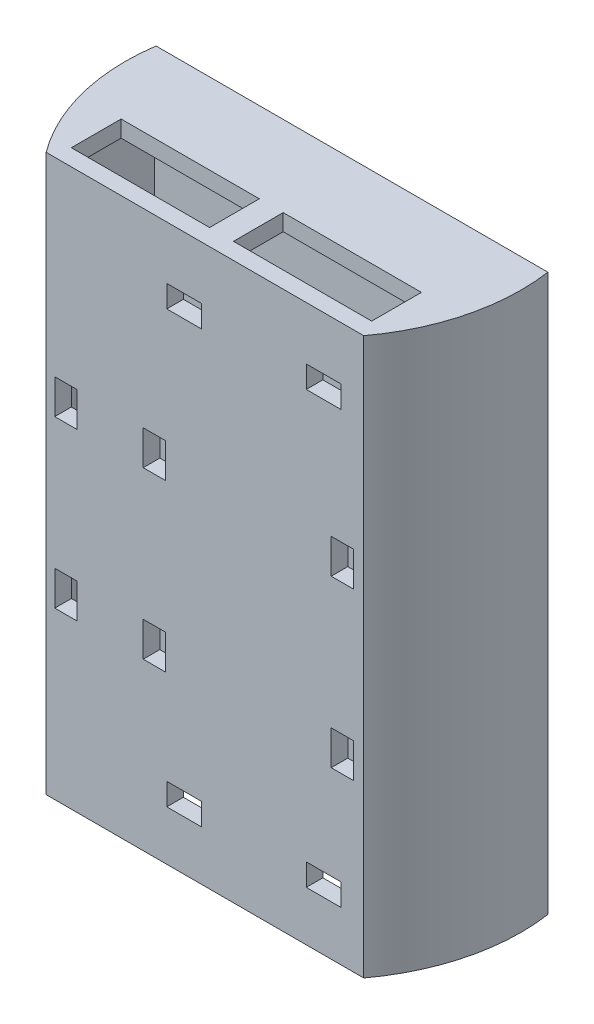
from build123d import *

# Parameters (mm, degrees)
BOSS_EXTRUDE1_DEPTH = 97.62
SKETCH2_W           = 4
SKETCH2_H           = 6.25
SKETCH2_W_2         = 6.25
SKETCH2_H_2         = 4
CUT_EXTRUDE1_DEPTH  = 3
SKETCH5_W           = 25
SKETCH5_H           = 9
BOSS_EXTRUDE4_DEPTH = 3


with BuildPart() as part:
    # Sketch1 → Boss-Extrude1 (new body)
    with BuildSketch(Plane(origin=(0, 0, 0), x_dir=(1, 0, 0), z_dir=(0, 1, 0))):
        with BuildLine():
            Line((-32.735485333, 2.21), (-35.741740305, 2.21))
            ThreePointArc((-35.741740305, 2.21), (-34.793989799, -8.469614742), (-30.727251748, -18.39))
            Line((-30.727251748, -18.39), (-27.171750036, -18.39))
            ThreePointArc((-27.171750036, -18.39), (-31.675056628, -8.554933525), (-32.735485333, 2.21))
        make_face()
        with BuildLine():
            ThreePointArc((35.81, 0), (35.792931008, 1.105526954), (35.741740305, 2.21))
            Line((35.741740305, 2.21), (32.735485333, 2.21))
            ThreePointArc((32.735485333, 2.21), (32.791366042, 1.105627925), (32.81, 0))
            ThreePointArc((32.81, 0), (31.368783995, -9.617457599), (27.171750036, -18.39))
            Line((27.171750036, -18.39), (30.727251748, -18.39))
            ThreePointArc((30.727251748, -18.39), (34.515930996, -9.539738332), (35.81, 0))
        make_face()
        with BuildLine():
            ThreePointArc((-30.727251748, -18.39), (-29.761325298, -19.915311108), (-28.719749303, -21.39))
            Line((-28.719749303, -21.39), (-24.878987118, -21.39))
            ThreePointArc((-24.878987118, -21.39), (-26.06855979, -19.923009071), (-27.171750036, -18.39))
            Line((-27.171750036, -18.39), (-30.727251748, -18.39))
        make_face()
        with BuildLine():
            Line((24.878987118, -21.39), (28.719749303, -21.39))
            ThreePointArc((28.719749303, -21.39), (29.761325298, -19.915311108), (30.727251748, -18.39))
            Line((30.727251748, -18.39), (27.171750036, -18.39))
            ThreePointArc((27.171750036, -18.39), (26.06855979, -19.923009071), (24.878987118, -21.39))
        make_face()
        with BuildLine():
            ThreePointArc((-27.171750036, -18.39), (-26.06855979, -19.923009071), (-24.878987118, -21.39))
            Line((-24.878987118, -21.39), (24.878987118, -21.39))
            ThreePointArc((24.878987118, -21.39), (26.06855979, -19.923009071), (27.171750036, -18.39))
            Line((27.171750036, -18.39), (-27.171750036, -18.39))
        make_face()
        with BuildLine():
            Line((-32.393703092, 5.21), (-35.428971196, 5.21))
            ThreePointArc((-35.428971196, 5.21), (-35.616955848, 3.713294511), (-35.741740305, 2.21))
            Line((-35.741740305, 2.21), (-32.735485333, 2.21))
            ThreePointArc((-32.735485333, 2.21), (-32.59912263, 3.713933733), (-32.393703092, 5.21))
        make_face()
        with BuildLine():
            ThreePointArc((35.741740305, 2.21), (35.616955848, 3.713294511), (35.428971196, 5.21))
            Line((35.428971196, 5.21), (32.393703092, 5.21))
            ThreePointArc((32.393703092, 5.21), (32.59912263, 3.713933733), (32.735485333, 2.21))
            Line((32.735485333, 2.21), (35.741740305, 2.21))
        make_face()
        with BuildLine():
            Line((32.393703092, 5.21), (-32.393703092, 5.21))
            ThreePointArc((-32.393703092, 5.21), (-32.59912263, 3.713933733), (-32.735485333, 2.21))
            Line((-32.735485333, 2.21), (32.735485333, 2.21))
            ThreePointArc((32.735485333, 2.21), (32.59912263, 3.713933733), (32.393703092, 5.21))
        make_face()
        with BuildLine():
            Line((-32.393703092, 5.21), (-35.428971196, 5.21))
            ThreePointArc((-35.428971196, 5.21), (-35.616955848, 3.713294511), (-35.741740305, 2.21))
            Line((-35.741740305, 2.21), (-32.735485333, 2.21))
            ThreePointArc((-32.735485333, 2.21), (-32.59912263, 3.713933733), (-32.393703092, 5.21))
        make_face()
        with BuildLine():
            ThreePointArc((35.741740305, 2.21), (35.616955848, 3.713294511), (35.428971196, 5.21))
            Line((35.428971196, 5.21), (32.393703092, 5.21))
            ThreePointArc((32.393703092, 5.21), (32.59912263, 3.713933733), (32.735485333, 2.21))
            Line((32.735485333, 2.21), (35.741740305, 2.21))
        make_face()
        with BuildLine():
            Line((-32.735485333, 2.21), (-35.741740305, 2.21))
            ThreePointArc((-35.741740305, 2.21), (-34.793989799, -8.469614742), (-30.727251748, -18.39))
            Line((-30.727251748, -18.39), (-27.171750036, -18.39))
            ThreePointArc((-27.171750036, -18.39), (-31.675056628, -8.554933525), (-32.735485333, 2.21))
        make_face()
        with BuildLine():
            ThreePointArc((35.81, 0), (35.792931008, 1.105526954), (35.741740305, 2.21))
            Line((35.741740305, 2.21), (32.735485333, 2.21))
            ThreePointArc((32.735485333, 2.21), (32.791366042, 1.105627925), (32.81, 0))
            ThreePointArc((32.81, 0), (31.368783995, -9.617457599), (27.171750036, -18.39))
            Line((27.171750036, -18.39), (30.727251748, -18.39))
            ThreePointArc((30.727251748, -18.39), (34.515930996, -9.539738332), (35.81, 0))
        make_face()
        with BuildLine():
            ThreePointArc((-30.727251748, -18.39), (-29.761325298, -19.915311108), (-28.719749303, -21.39))
            Line((-28.719749303, -21.39), (-24.878987118, -21.39))
            ThreePointArc((-24.878987118, -21.39), (-26.06855979, -19.923009071), (-27.171750036, -18.39))
            Line((-27.171750036, -18.39), (-30.727251748, -18.39))
        make_face()
        with BuildLine():
            Line((24.878987118, -21.39), (28.719749303, -21.39))
            ThreePointArc((28.719749303, -21.39), (29.761325298, -19.915311108), (30.727251748, -18.39))
            Line((30.727251748, -18.39), (27.171750036, -18.39))
            ThreePointArc((27.171750036, -18.39), (26.06855979, -19.923009071), (24.878987118, -21.39))
        make_face()
    extrude(amount=BOSS_EXTRUDE1_DEPTH)

    # Sketch2 → Cut-Extrude1 (cut)
    with BuildSketch(Plane(origin=(-23.61, 0, 21.39), x_dir=(-1, 0, 0), z_dir=(0, 0, -1))):
        with Locations((1.550812332, 63.125)):
            Rectangle(SKETCH2_W, SKETCH2_H)
        with Locations((-14.449187668, 33.125)):
            Rectangle(SKETCH2_W, SKETCH2_H)
        with Locations((-14.449187668, 63.125)):
            Rectangle(SKETCH2_W, SKETCH2_H)
        with Locations((-19.832327081, 89)):
            Rectangle(SKETCH2_W_2, SKETCH2_H_2)
        with Locations((-45.066048255, 89)):
            Rectangle(SKETCH2_W_2, SKETCH2_H_2)
        with Locations((-48.449187668, 63.125)):
            Rectangle(SKETCH2_W, SKETCH2_H)
        with Locations((-45.066048255, 11)):
            Rectangle(SKETCH2_W_2, SKETCH2_H_2)
        with Locations((-19.832327081, 11)):
            Rectangle(SKETCH2_W_2, SKETCH2_H_2)
        with Locations((1.550812332, 33.125)):
            Rectangle(SKETCH2_W, SKETCH2_H)
        with Locations((-48.449187668, 33.125)):
            Rectangle(SKETCH2_W, SKETCH2_H)
    extrude(amount=CUT_EXTRUDE1_DEPTH, mode=Mode.SUBTRACT)

    # Sketch5 → Boss-Extrude4 (add)
    with BuildSketch(Plane(origin=(0, 97.62, 0), x_dir=(1, 0, 0), z_dir=(0, 1, 0))):
        with BuildLine():
            Line((35.428971196, 5.21), (-35.428971196, 5.21))
            ThreePointArc((-35.428971196, 5.21), (-34.722537139, -8.757940089), (-28.719749303, -21.39))
            Line((-28.719749303, -21.39), (28.719749303, -21.39))
            ThreePointArc((28.719749303, -21.39), (34.722537139, -8.757940089), (35.428971196, 5.21))
        make_face()
        with Locations((-14.660228428, -13.89)):
            Rectangle(SKETCH5_W, SKETCH5_H, mode=Mode.SUBTRACT)
        with Locations((14.660228428, -13.89)):
            Rectangle(SKETCH5_W, SKETCH5_H, mode=Mode.SUBTRACT)
    extrude(amount=BOSS_EXTRUDE4_DEPTH)


solid = part.part
